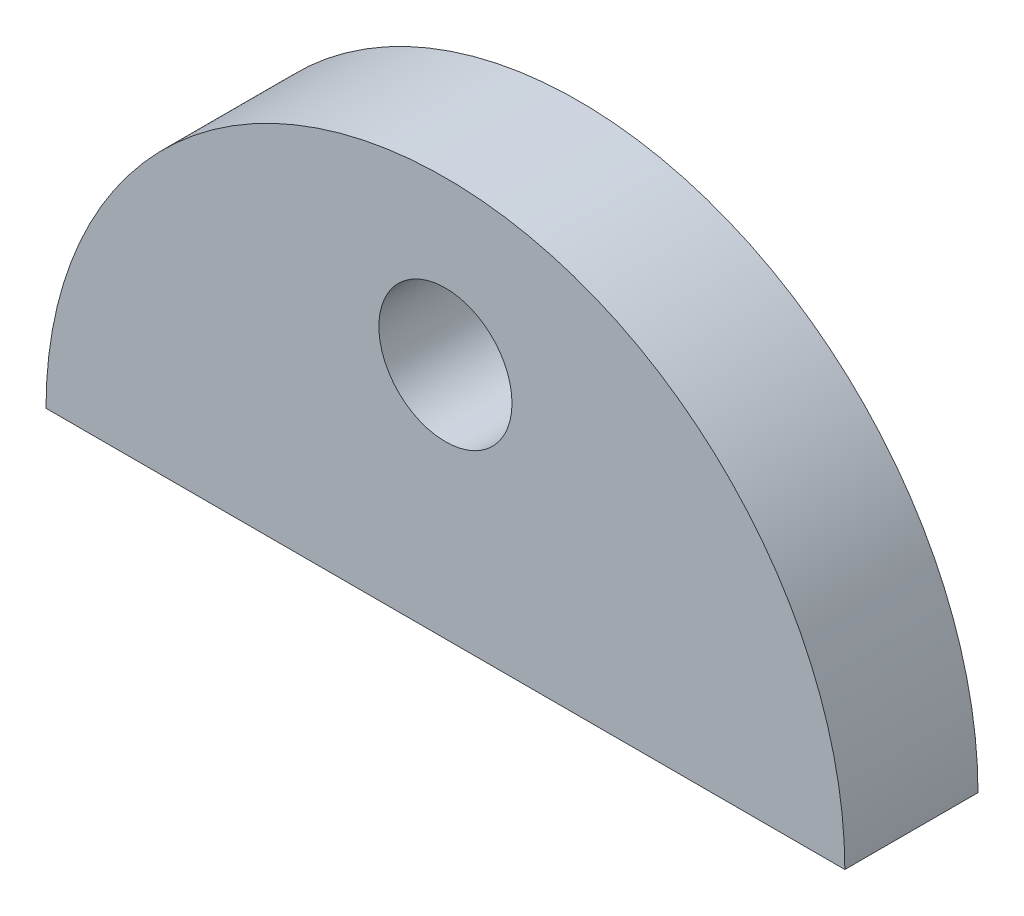
from build123d import *

# Parameters (mm, degrees)
SKETCH2_R           = 3.175
BOSS_EXTRUDE1_DEPTH = 6.35
SCALE1_SCALE        = 1.5
SCALE2_SCALE        = 0.67
SCALE3_SCALE        = 2


with BuildPart() as part:
    # Sketch2 → Boss-Extrude1 (new body)
    with BuildSketch(Plane.XY):
        with BuildLine():
            Line((-38.1, 0), (0, 0))
            ThreePointArc((0, 0), (-19.05, 19.05), (-38.1, 0))
        make_face()
        with Locations((-19.05, 11.320090227)):
            Circle(SKETCH2_R, mode=Mode.SUBTRACT)
    extrude(amount=BOSS_EXTRUDE1_DEPTH)


with BuildPart() as part_1:
    # Scale1: scaled about (-19.05, 7.894775867, 3.175)
    add(part.part.scale(SCALE1_SCALE).moved(Location((9.525, -3.947387933, -1.5875))))


with BuildPart() as part_2:
    # Scale2: scaled about (-19.05, 7.894775867, 3.175)
    add(part_1.part.scale(SCALE2_SCALE).moved(Location((-6.2865, 2.605276036, 1.04775))))


with BuildPart() as part_3:
    # Scale3: scaled about (-19.05, 7.894775867, 3.175)
    add(part_2.part.scale(SCALE3_SCALE).moved(Location((19.05, -7.894775867, -3.175))))


solid = part_3.part
